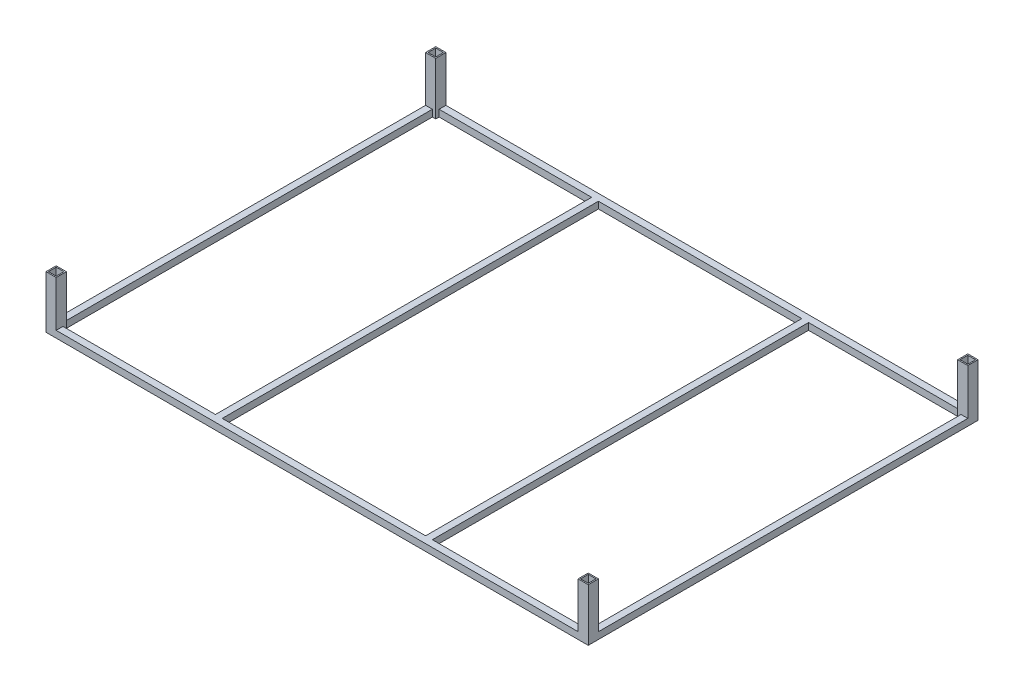
from build123d import *

# Parameters (mm, degrees)
BOSS_EXTRUDE1_START  = -3200
SKETCH1_W            = 80
SKETCH1_H            = 80
SKETCH1_W_2          = 74
SKETCH1_H_2          = 74
BOSS_EXTRUDE1_DEPTH  = 6400
BOSS_EXTRUDE2_START  = -3200
SKETCH2_W            = 80
SKETCH2_H            = 80
SKETCH2_W_2          = 74
SKETCH2_H_2          = 74
BOSS_EXTRUDE2_DEPTH  = 6400
BOSS_EXTRUDE3_START  = -2220
SKETCH3_W            = 80
SKETCH3_H            = 80
SKETCH3_W_2          = 74
SKETCH3_H_2          = 74
BOSS_EXTRUDE3_DEPTH  = 4440
BOSS_EXTRUDE4_START  = -2220
SKETCH4_W            = 80
SKETCH4_H            = 80
SKETCH4_W_2          = 74
SKETCH4_H_2          = 74
BOSS_EXTRUDE4_DEPTH  = 4440
BOSS_EXTRUDE5_START  = -2220
SKETCH5_W            = 80
SKETCH5_H            = 80
SKETCH5_W_2          = 74
SKETCH5_H_2          = 74
BOSS_EXTRUDE5_DEPTH  = 4440
BOSS_EXTRUDE6_START  = -2220
SKETCH6_W            = 80
SKETCH6_H            = 80
SKETCH6_W_2          = 74
SKETCH6_H_2          = 74
BOSS_EXTRUDE6_DEPTH  = 4440
BOSS_EXTRUDE7_START  = -310
SKETCH7_W            = 120
SKETCH7_H            = 120
SKETCH7_W_2          = 91.406932704
SKETCH7_H_2          = 91.406932704
BOSS_EXTRUDE7_DEPTH  = 620
BOSS_EXTRUDE8_START  = -310
SKETCH8_W            = 120
SKETCH8_H            = 120
SKETCH8_W_2          = 91.406932704
SKETCH8_H_2          = 91.406932704
BOSS_EXTRUDE8_DEPTH  = 620
BOSS_EXTRUDE9_START  = -310
SKETCH9_W            = 120
SKETCH9_H            = 120
SKETCH9_W_2          = 91.406932704
SKETCH9_H_2          = 91.406932704
BOSS_EXTRUDE9_DEPTH  = 620
BOSS_EXTRUDE10_START = -310
SKETCH10_W           = 120
SKETCH10_H           = 120
SKETCH10_W_2         = 91.406932704
SKETCH10_H_2         = 91.406932704
BOSS_EXTRUDE10_DEPTH = 620


with BuildPart() as part:
    # Sketch1 → Boss-Extrude1 (new body)
    with BuildSketch(Plane(origin=(0, 0, 0), x_dir=(0, 0, -1), z_dir=(1, 0, 0)).offset(BOSS_EXTRUDE1_START)):
        with Locations((2260, -270)):
            Rectangle(SKETCH1_W, SKETCH1_H)
        with Locations((2260, -270)):
            Rectangle(SKETCH1_W_2, SKETCH1_H_2, mode=Mode.SUBTRACT)
    extrude(amount=BOSS_EXTRUDE1_DEPTH)



with BuildPart() as body_2:
    # Sketch2 → Boss-Extrude2 (new body)
    with BuildSketch(Plane(origin=(0, 0, 0), x_dir=(0, 0, -1), z_dir=(1, 0, 0)).offset(BOSS_EXTRUDE2_START)):
        with Locations((-2260, -270)):
            Rectangle(SKETCH2_W, SKETCH2_H)
        with Locations((-2260, -270)):
            Rectangle(SKETCH2_W_2, SKETCH2_H_2, mode=Mode.SUBTRACT)
    extrude(amount=BOSS_EXTRUDE2_DEPTH)


with BuildPart() as part_1:
    add(part.part)

    add(body_2.part)  # Boss-Extrude3 merges body 2
    # Sketch3 → Boss-Extrude3 (add)
    with BuildSketch(Plane.XY.offset(BOSS_EXTRUDE3_START)):
        with Locations((-3160, -270)):
            Rectangle(SKETCH3_W, SKETCH3_H)
        with Locations((-3160, -270)):
            Rectangle(SKETCH3_W_2, SKETCH3_H_2, mode=Mode.SUBTRACT)
    extrude(amount=BOSS_EXTRUDE3_DEPTH)

    # Sketch4 → Boss-Extrude4 (add)
    with BuildSketch(Plane.XY.offset(BOSS_EXTRUDE4_START)):
        with Locations((-1240, -270)):
            Rectangle(SKETCH4_W, SKETCH4_H)
        with Locations((-1240, -270)):
            Rectangle(SKETCH4_W_2, SKETCH4_H_2, mode=Mode.SUBTRACT)
    extrude(amount=BOSS_EXTRUDE4_DEPTH)

    # Sketch5 → Boss-Extrude5 (add)
    with BuildSketch(Plane.XY.offset(BOSS_EXTRUDE5_START)):
        with Locations((3160, -270)):
            Rectangle(SKETCH5_W, SKETCH5_H)
        with Locations((3160, -270)):
            Rectangle(SKETCH5_W_2, SKETCH5_H_2, mode=Mode.SUBTRACT)
    extrude(amount=BOSS_EXTRUDE5_DEPTH)

    # Sketch6 → Boss-Extrude6 (add)
    with BuildSketch(Plane.XY.offset(BOSS_EXTRUDE6_START)):
        with Locations((1240, -270)):
            Rectangle(SKETCH6_W, SKETCH6_H)
        with Locations((1240, -270)):
            Rectangle(SKETCH6_W_2, SKETCH6_H_2, mode=Mode.SUBTRACT)
    extrude(amount=BOSS_EXTRUDE6_DEPTH)

    # Sketch7 → Boss-Extrude7 (add)
    with BuildSketch(Plane(origin=(0, 0, 0), x_dir=(1, 0, 0), z_dir=(0, 1, 0)).offset(BOSS_EXTRUDE7_START)):
        with Locations((-3140, 2240)):
            Rectangle(SKETCH7_W, SKETCH7_H)
        with Locations((-3140, 2240)):
            Rectangle(SKETCH7_W_2, SKETCH7_H_2, mode=Mode.SUBTRACT)
    extrude(amount=BOSS_EXTRUDE7_DEPTH)

    # Sketch8 → Boss-Extrude8 (add)
    with BuildSketch(Plane(origin=(0, 0, 0), x_dir=(1, 0, 0), z_dir=(0, 1, 0)).offset(BOSS_EXTRUDE8_START)):
        with Locations((-3140, -2240)):
            Rectangle(SKETCH8_W, SKETCH8_H)
        with Locations((-3140, -2240)):
            Rectangle(SKETCH8_W_2, SKETCH8_H_2, mode=Mode.SUBTRACT)
    extrude(amount=BOSS_EXTRUDE8_DEPTH)

    # Sketch9 → Boss-Extrude9 (add)
    with BuildSketch(Plane(origin=(0, 0, 0), x_dir=(1, 0, 0), z_dir=(0, 1, 0)).offset(BOSS_EXTRUDE9_START)):
        with Locations((3140, 2240)):
            Rectangle(SKETCH9_W, SKETCH9_H)
        with Locations((3140, 2240)):
            Rectangle(SKETCH9_W_2, SKETCH9_H_2, mode=Mode.SUBTRACT)
    extrude(amount=BOSS_EXTRUDE9_DEPTH)

    # Sketch10 → Boss-Extrude10 (add)
    with BuildSketch(Plane(origin=(0, 0, 0), x_dir=(1, 0, 0), z_dir=(0, 1, 0)).offset(BOSS_EXTRUDE10_START)):
        with Locations((3140, -2240)):
            Rectangle(SKETCH10_W, SKETCH10_H)
        with Locations((3140, -2240)):
            Rectangle(SKETCH10_W_2, SKETCH10_H_2, mode=Mode.SUBTRACT)
    extrude(amount=BOSS_EXTRUDE10_DEPTH)


solid = part_1.part
